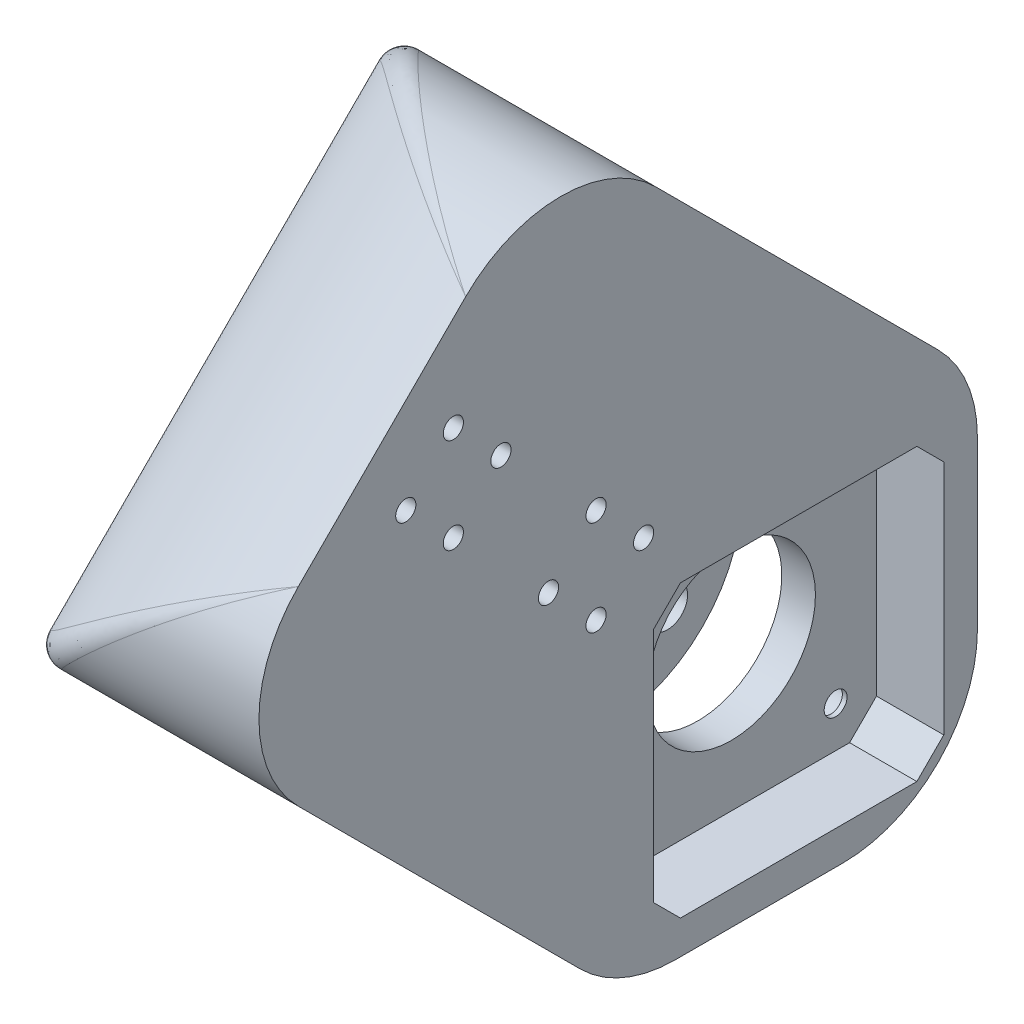
from build123d import *

# Parameters (mm, degrees)
BOSS_EXTRUDE1_DEPTH                              = 5
BOSS_EXTRUDE2_START                              = 5
SKETCH1_3_W                                      = 43.15
SKETCH1_3_H                                      = 43.15
BOSS_EXTRUDE2_DEPTH                              = 10
SKETCH6_R                                        = 12.5
CUT_EXTRUDE1_DEPTH                               = 10
CHAMFER1_SIZE                                    = 4
BOSS_EXTRUDE10_DEPTH                             = 75.16545084
BOSS_EXTRUDE11_START                             = -33
SKETCH1_5_W                                      = 43.15
SKETCH1_5_H                                      = 43.15
BOSS_EXTRUDE11_DEPTH                             = 13
FILLET1_R                                        = 20
SKETCH11_R                                       = 11
SKETCH11_R_2                                     = 4.5
CUT_EXTRUDE2_DEPTH                               = 7
SKETCH11_2_R                                     = 4.5
CUT_EXTRUDE3_DEPTH                               = 121.73251195
CBORE_FOR_M3_HEX_HEAD_MACHINE_SCREW2_D           = 3.4
CBORE_FOR_M3_HEX_HEAD_MACHINE_SCREW2_DEPTH       = 15
CBORE_FOR_M3_HEX_HEAD_MACHINE_SCREW2_CBORE_D     = 6
CBORE_FOR_M3_HEX_HEAD_MACHINE_SCREW2_CBORE_DEPTH = 4.3
SKETCH13_R                                       = 3
CUT_EXTRUDE4_DEPTH                               = 13
F_3_0MM_DOWEL_HOLE1_D                            = 3
F_3_0MM_DOWEL_HOLE1_DEPTH                        = 7
F_3_0MM_DOWEL_HOLE1_TIP                          = 0.901290929
CUT_EXTRUDE5_DEPTH                               = 124.985082537
FILLET2_R                                        = 3


with BuildPart() as part:
    # Sketch1 → Boss-Extrude1 (new body)
    with BuildSketch(Plane(origin=(0, 0, 0), x_dir=(0, 0, -1), z_dir=(1, 0, 0))):
        Polygon((15.5, 68.65), (-37.65, 15.5), (-11.075, -11.075), (42.075, -11.075), (42.075, 42.075), align=None)
    extrude(amount=BOSS_EXTRUDE1_DEPTH)

    # Sketch1<3> → Boss-Extrude2 (add)
    with BuildSketch(Plane(origin=(0, 0, 0), x_dir=(0, 0, -1), z_dir=(1, 0, 0)).offset(BOSS_EXTRUDE2_START)):
        Polygon((42.075, -11.075), (42.075, 42.075), (15.5, 68.65), (-11.075, 42.075), (-37.65, 15.5), (-11.075, -11.075), align=None)
        with Locations((15.5, 15.5)):
            Rectangle(SKETCH1_3_W, SKETCH1_3_H, mode=Mode.SUBTRACT)
    extrude(amount=BOSS_EXTRUDE2_DEPTH)

    # Sketch6 → Cut-Extrude1 (cut)
    with BuildSketch(Plane.ZY):
        with Locations((-15.5, 15.5)):
            Circle(SKETCH6_R)
    extrude(amount=-CUT_EXTRUDE1_DEPTH, mode=Mode.SUBTRACT)

    # Chamfer1
    chamfer1_edges = [part.edges().sort_by_distance(p)[0] for p in [
        (10, 37.075, -37.075),
        (10, 37.075, 6.075),
        (10, -6.075, 6.075),
        (10, -6.075, -37.075),
    ]]
    chamfer(chamfer1_edges, length=CHAMFER1_SIZE)

    # Sketch8 → Boss-Extrude10 (add)
    with BuildSketch(Plane(origin=(0, -11.075, 11.075), x_dir=(1, 0, 0), z_dir=(0, -0.7071067811865476, 0.7071067811865476))):
        with BuildLine():
            Line((15, 37.58272542), (15, 87.58272542))
            Line((15, 87.58272542), (-33, 87.58272542))
            Line((-33, 87.58272542), (-33, 37.58272542))
            Line((-33, 37.58272542), (-20, 37.58272542))
            Line((-20, 37.58272542), (-20, 47.58272542))
            ThreePointArc((-20, 47.58272542), (-10, 57.58272542), (0, 47.58272542))
            Line((0, 47.58272542), (0, 37.58272542))
            Line((0, 37.58272542), (15, 37.58272542))
        make_face()
    extrude(amount=-BOSS_EXTRUDE10_DEPTH)

    # Sketch1<5> → Boss-Extrude11 (add)
    # profile 1 of 2: a face of its own
    with BuildSketch(Plane(origin=(0, 0, 0), x_dir=(0, 0, -1), z_dir=(1, 0, 0)).offset(BOSS_EXTRUDE11_START)):
        Polygon((15.5, 68.65), (42.075, 42.075), (42.075, -11.075), (-11.075, -11.075), (-37.65, 15.5), (-11.075, 42.075), align=None)
        with Locations((15.5, 15.5)):
            Rectangle(SKETCH1_5_W, SKETCH1_5_H, mode=Mode.SUBTRACT)
    # profile 2 of 2: a face of its own
    with BuildSketch(Plane(origin=(0, 0, 0), x_dir=(0, 0, -1), z_dir=(1, 0, 0)).offset(BOSS_EXTRUDE11_START)):
        with Locations((15.5, 15.5)):
            Rectangle(SKETCH1_5_W, SKETCH1_5_H)
    extrude(amount=BOSS_EXTRUDE11_DEPTH)

    # Fillet1
    fillet1_edges = [part.edges().sort_by_distance(p)[0] for p in [
        (7.5, 42.075, -42.075),
        (7.5, -11.075, -42.075),
        (7.5, -11.075, 11.075),
        (-9, 50.855339059, 73.005339059),
        (-9, 104.005339059, 19.855339059),
        (-26.5, -11.075, 11.075),
        (-26.5, -11.075, -42.075),
        (-26.5, 42.075, -42.075),
    ]]
    fillet(fillet1_edges, radius=FILLET1_R)

    # Sketch11 → Cut-Extrude2 (cut)
    with BuildSketch(Plane(origin=(-20, 0, 0), x_dir=(0, 0, -1), z_dir=(1, 0, 0))):
        with Locations((15.5, 15.5)):
            Circle(SKETCH11_R)
        with Locations((15.5, 15.5)):
            Circle(SKETCH11_R_2, mode=Mode.SUBTRACT)
    extrude(amount=-CUT_EXTRUDE2_DEPTH, mode=Mode.SUBTRACT)

    # Sketch11<2> → Cut-Extrude3 (cut, through all)
    with BuildSketch(Plane(origin=(-20, 0, 0), x_dir=(0, 0, -1), z_dir=(1, 0, 0))):
        with Locations((15.5, 15.5)):
            Circle(SKETCH11_2_R)
    extrude(amount=-CUT_EXTRUDE3_DEPTH, mode=Mode.SUBTRACT)

    # CBORE for M3 Hex Head Machine Screw2
    with Locations(Plane.ZY):
        with Locations((-31, 31), (0, 0), (0, 31), (-31, 0)):
            CounterBoreHole(CBORE_FOR_M3_HEX_HEAD_MACHINE_SCREW2_D / 2, CBORE_FOR_M3_HEX_HEAD_MACHINE_SCREW2_CBORE_D / 2, CBORE_FOR_M3_HEX_HEAD_MACHINE_SCREW2_CBORE_DEPTH, depth=CBORE_FOR_M3_HEX_HEAD_MACHINE_SCREW2_DEPTH)

    # Sketch13 → Cut-Extrude4 (cut)
    with BuildSketch(Plane.ZY.offset(33)):
        with Locations((0, 31)):
            Circle(SKETCH13_R)
        Circle(SKETCH13_R)
        with Locations((-31, 0)):
            Circle(SKETCH13_R)
        with Locations((-31, 31)):
            Circle(SKETCH13_R)
    extrude(amount=-CUT_EXTRUDE4_DEPTH, mode=Mode.SUBTRACT)

    # Ø3.0mm Dowel Hole1
    with Locations(Plane(origin=(15, 0, 0), x_dir=(0, 0, -1), z_dir=(1, 0, 0))):
        with Locations((-35.823737342, 73.894805153), (-42.894805153, 66.823737342), (-35.823737342, 59.75266953), (-28.75266953, 66.823737342), (-14.610533906, 52.681601718), (-21.681601718, 45.610533906), (-14.610533906, 38.539466094), (-7.539466094, 45.610533906)):
            Hole(F_3_0MM_DOWEL_HOLE1_D / 2, depth=F_3_0MM_DOWEL_HOLE1_DEPTH)
            with Locations((0, 0, -(F_3_0MM_DOWEL_HOLE1_DEPTH + F_3_0MM_DOWEL_HOLE1_TIP / 2))):  # 118° drill point
                Cone(0, F_3_0MM_DOWEL_HOLE1_D / 2, F_3_0MM_DOWEL_HOLE1_TIP, mode=Mode.SUBTRACT)

    # Sketch16 → Cut-Extrude5 (cut, through all)
    with BuildSketch(Plane(origin=(0, -11.075, 11.075), x_dir=(1, 0, 0), z_dir=(0, -0.7071067811865476, 0.7071067811865476))):
        with BuildLine():
            Line((-33, 39.58272542), (-33, 87.58272542))
            Line((-33, 87.58272542), (15, 87.58272542))
            ThreePointArc((15, 87.58272542), (-18.941125497, 73.523850917), (-33, 39.58272542))
        make_face()
    extrude(amount=-CUT_EXTRUDE5_DEPTH, mode=Mode.SUBTRACT)

    # Fillet2
    fillet2_edges = [part.edges().sort_by_distance(p)[0] for p in [
        (-33, 21.357864376, -42.075),
        (-33, -11.075, -9.642135624),
        (-33, 41.4443974, -40.55259065),
        (-33, -9.55259065, 10.4443974),
        (-33, -5.217135624, -36.217135624),
        (-5.851867026, 95.656214554, 21.464663316),
        (-33, 5.848538969, 27.998538969),
        (-33, 58.291432188, -25.858567812),
        (-30.691271126, 27.313918916, 49.463918916),
        (-5.851867021, 52.464663309, 64.656214565),
        (-30.691271126, 80.463918916, -3.686081084),
    ]]
    fillet(fillet2_edges, radius=FILLET2_R)


solid = part.part
